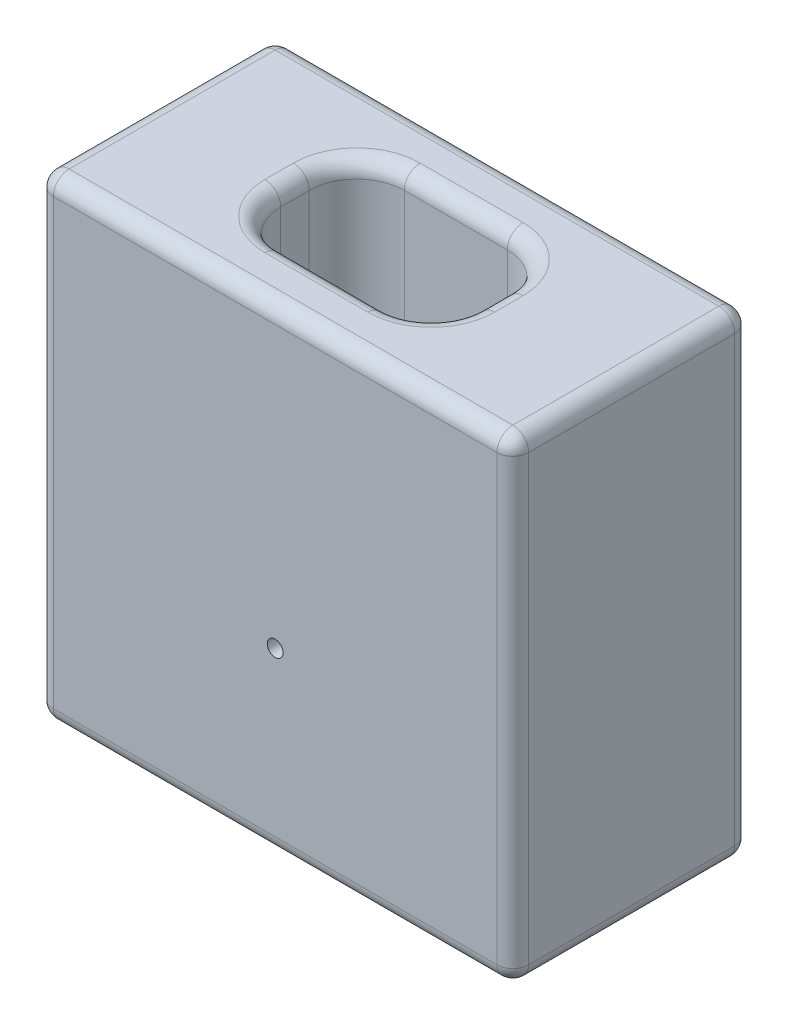
from build123d import *

# Parameters (mm, degrees)
SKETCH1_W           = 38.1
SKETCH1_H           = 19.05
BOSS_EXTRUDE1_DEPTH = 12.7
SKETCH2_W           = 38.1
SKETCH2_H           = 19.05
SKETCH2_W_2         = 15.875
SKETCH2_H_2         = 9.906
BOSS_EXTRUDE2_DEPTH = 25.4
SKETCH2_3_W         = 8.128
SKETCH2_3_H         = 8.128
BOSS_EXTRUDE3_DEPTH = 10.16
FILLET1_R           = 1.905
SKETCH3_R           = 0.635
CUT_EXTRUDE1_DEPTH  = 47.6627796
FILLET2_R           = 3.81
BOSS_EXTRUDE4_START = 6.35
SKETCH4_R           = 0.635
BOSS_EXTRUDE4_DEPTH = 6.35
FILLET3_R           = 1.27


with BuildPart() as part:
    # Sketch1 → Boss-Extrude1 (new body)
    with BuildSketch(Plane(origin=(0, 0, 0), x_dir=(1, 0, 0), z_dir=(0, 1, 0))):
        Rectangle(SKETCH1_W, SKETCH1_H)
    extrude(amount=BOSS_EXTRUDE1_DEPTH)

    # Sketch2 → Boss-Extrude2 (add)
    with BuildSketch(Plane(origin=(0, 12.7, 0), x_dir=(1, 0, 0), z_dir=(0, 1, 0))):
        Rectangle(SKETCH2_W, SKETCH2_H)
        Rectangle(SKETCH2_W_2, SKETCH2_H_2, mode=Mode.SUBTRACT)
    extrude(amount=BOSS_EXTRUDE2_DEPTH)

    # Sketch2<3> → Boss-Extrude3 (add)
    with BuildSketch(Plane(origin=(0, 12.7, 0), x_dir=(1, 0, 0), z_dir=(0, 1, 0))):
        Rectangle(SKETCH2_3_W, SKETCH2_3_H)
    extrude(amount=BOSS_EXTRUDE3_DEPTH)

    # Fillet1
    fillet1_edges = [part.edges().sort_by_distance(p)[0] for p in [
        (-4.064, 17.78, 4.064),
        (4.064, 17.78, 4.064),
        (4.064, 17.78, -4.064),
        (-4.064, 17.78, -4.064),
    ]]
    fillet(fillet1_edges, radius=FILLET1_R)

    # Sketch3 → Cut-Extrude1 (cut, through all)
    with BuildSketch(Plane(origin=(0, 0, -9.525), x_dir=(-1, 0, 0), z_dir=(0, 0, -1))):
        with Locations((0, 14.351)):
            Circle(SKETCH3_R)
    extrude(amount=-CUT_EXTRUDE1_DEPTH, mode=Mode.SUBTRACT)

    # Fillet2
    fillet2_edges = [part.edges().sort_by_distance(p)[0] for p in [
        (7.9375, 25.4, 4.953),
        (7.9375, 25.4, -4.953),
        (-7.9375, 25.4, 4.953),
        (-7.9375, 25.4, -4.953),
    ]]
    fillet(fillet2_edges, radius=FILLET2_R)

    # Sketch4 → Boss-Extrude4 (add)
    with BuildSketch(Plane(origin=(0, 0, -9.525), x_dir=(-1, 0, 0), z_dir=(0, 0, -1)).offset(BOSS_EXTRUDE4_START)):
        with BuildLine():
            Line((5.08, 0), (5.08, 14.351))
            ThreePointArc((5.08, 14.351), (0, 19.431), (-5.08, 14.351))
            Line((-5.08, 14.351), (-5.08, 0))
            Line((-5.08, 0), (5.08, 0))
        make_face()
        with Locations((0, 14.351)):
            Circle(SKETCH4_R, mode=Mode.SUBTRACT)
    extrude(amount=-BOSS_EXTRUDE4_DEPTH)

    # Fillet3
    fillet3_edges = [part.edges().sort_by_distance(p)[0] for p in [
        (-12.065, 0, -9.525),
        (12.065, 0, -9.525),
        (0, 0, 9.525),
        (19.05, 19.05, 9.525),
        (19.05, 19.05, -9.525),
        (19.05, 0, 0),
        (-19.05, 19.05, -9.525),
        (-19.05, 19.05, 9.525),
        (-19.05, 0, 0),
        (6.821576836, 38.1, 3.837076836),
        (7.9375, 38.1, 0),
        (6.821576836, 38.1, -3.837076836),
        (0, 38.1, -4.953),
        (-6.821576836, 38.1, -3.837076836),
        (-7.9375, 38.1, 0),
        (-6.821576836, 38.1, 3.837076836),
        (0, 38.1, 4.953),
        (0, 38.1, -9.525),
        (19.05, 38.1, 0),
        (0, 38.1, 9.525),
        (-19.05, 38.1, 0),
        (-3.506038418, 22.86, -3.506038418),
        (0, 22.86, -4.064),
        (3.506038418, 22.86, -3.506038418),
        (4.064, 22.86, 0),
        (3.506038418, 22.86, 3.506038418),
        (0, 22.86, 4.064),
        (-3.506038418, 22.86, 3.506038418),
        (-4.064, 22.86, 0),
        (5.08, 0, -12.7),
        (0, 0, -15.875),
        (-5.08, 0, -12.7),
        (-5.08, 7.1755, -15.875),
        (0, 19.431, -15.875),
        (-5.08, 7.1755, -9.525),
        (0, 19.431, -9.525),
        (5.08, 7.1755, -15.875),
        (5.08, 7.1755, -9.525),
    ]]
    fillet(fillet3_edges, radius=FILLET3_R)


solid = part.part
